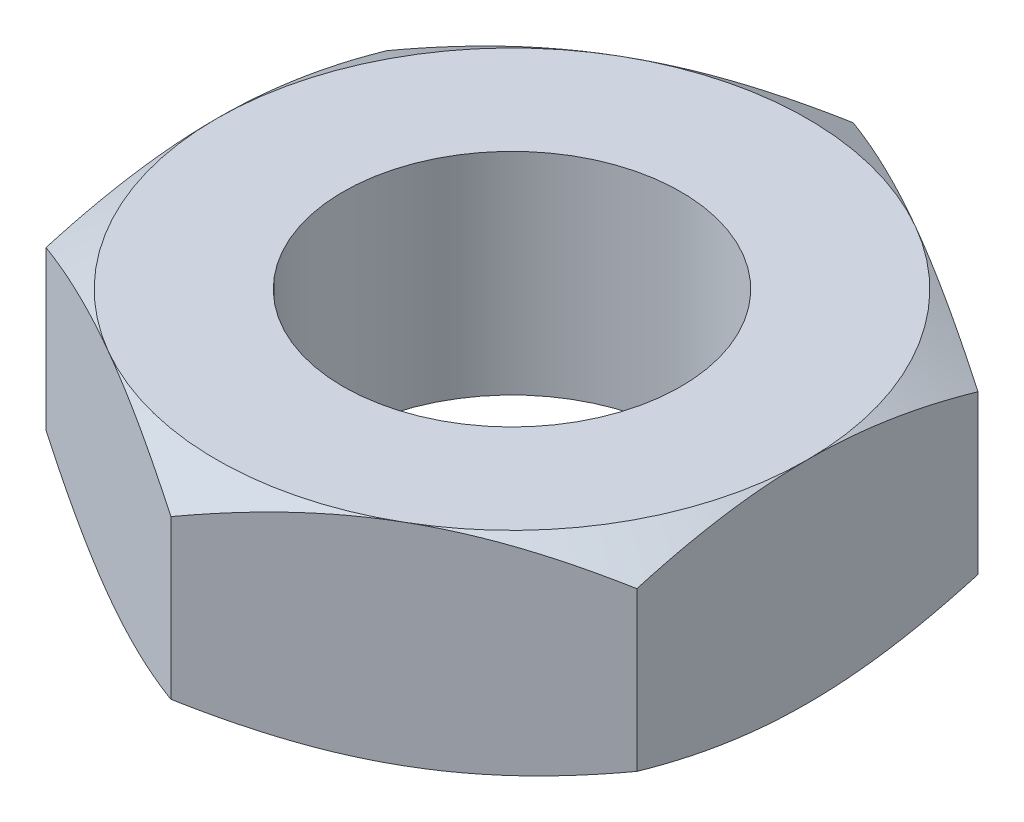
from build123d import *

# Parameters (mm, degrees)
SKETCH1_R               = 3.175
BOSS_EXTRUDE1_DEPTH     = 1.984375
SKETCH5_OUTSIDE_W       = 52.52
SKETCH5_OUTSIDE_H       = 54.24
SKETCH5_OUTSIDE_R       = 5.55625
CUT_EXTRUDE2_DEPTH      = 10.369388598
CUT_EXTRUDE2_DRAFT      = -60
MIRROR1_COPY_1_SKETCH_W = 52.52
MIRROR1_COPY_1_SKETCH_H = 54.24
MIRROR1_COPY_1_SKETCH_R = 5.55625
MIRROR1_COPY_1_DEPTH    = 10.369388598
MIRROR1_COPY_1_DRAFT    = -60


with BuildPart() as part:
    # Sketch1 → Boss-Extrude1 (new, symmetric)
    with BuildSketch(Plane(origin=(0, 0, 0), x_dir=(1, 0, 0), z_dir=(0, 1, 0))):
        Polygon((-5.55625, 3.207902433), (-5.55625, -3.207902433), (0, -6.415804866), (5.55625, -3.207902433), (5.55625, 3.207902433), (0, 6.415804866), align=None)
        with Locations(Location((0, 0, 0), (0, 0, 270))):
            Circle(SKETCH1_R, mode=Mode.SUBTRACT)
    extrude(amount=BOSS_EXTRUDE1_DEPTH, both=True)


with BuildPart() as cut_extrude2_tool:
    # Sketch5 outside → Cut-Extrude2 (with draft: the straight prism first)
    with BuildSketch(Plane(origin=(0, 1.984375, 0), x_dir=(1, 0, 0), z_dir=(0, 1, 0))):
        Rectangle(SKETCH5_OUTSIDE_W, SKETCH5_OUTSIDE_H)
        Circle(SKETCH5_OUTSIDE_R, mode=Mode.SUBTRACT)
    extrude(amount=-CUT_EXTRUDE2_DEPTH)
    # Cut-Extrude2: the draft: its side faces are tilted about the plane it starts from
    cut_extrude2_sides = [cut_extrude2_tool.faces().sort_by_distance(p)[0] for p in [
        (0, -3.200319299, 27.12),
        (26.26, -3.200319299, 0),
        (0, -3.200319299, -27.12),
        (-26.26, -3.200319299, 0),
        (-5.55625, -3.200319299, 0),
    ]]
    draft(cut_extrude2_sides, Plane(origin=(0, 1.984375, 0), x_dir=(1, 0, 0), z_dir=(0, 1, 0)), CUT_EXTRUDE2_DRAFT)


with BuildPart() as part_1:
    add(part.part)

    # Cut-Extrude2: cut by cut_extrude2_tool
    add(cut_extrude2_tool.part, mode=Mode.SUBTRACT)


with BuildPart() as mirror1_copy_1_tool:
    # Mirror1 copy 1 sketch → Mirror1 copy 1 (with draft: the straight prism first)
    with BuildSketch(Plane.XZ.offset(1.984375)):
        Rectangle(MIRROR1_COPY_1_SKETCH_W, MIRROR1_COPY_1_SKETCH_H)
        Circle(MIRROR1_COPY_1_SKETCH_R, mode=Mode.SUBTRACT)
    extrude(amount=-MIRROR1_COPY_1_DEPTH)
    # Mirror1 copy 1: the draft: its side faces are tilted about the plane it starts from
    mirror1_copy_1_sides = [mirror1_copy_1_tool.faces().sort_by_distance(p)[0] for p in [
        (0, 3.200319299, 27.12),
        (26.26, 3.200319299, 0),
        (0, 3.200319299, -27.12),
        (-26.26, 3.200319299, 0),
        (-5.55625, 3.200319299, 0),
    ]]
    draft(mirror1_copy_1_sides, Plane.XZ.offset(1.984375), MIRROR1_COPY_1_DRAFT)


with BuildPart() as part_2:
    add(part_1.part)

    # Mirror1 copy 1: cut by mirror1_copy_1_tool
    add(mirror1_copy_1_tool.part, mode=Mode.SUBTRACT)


solid = part_2.part
